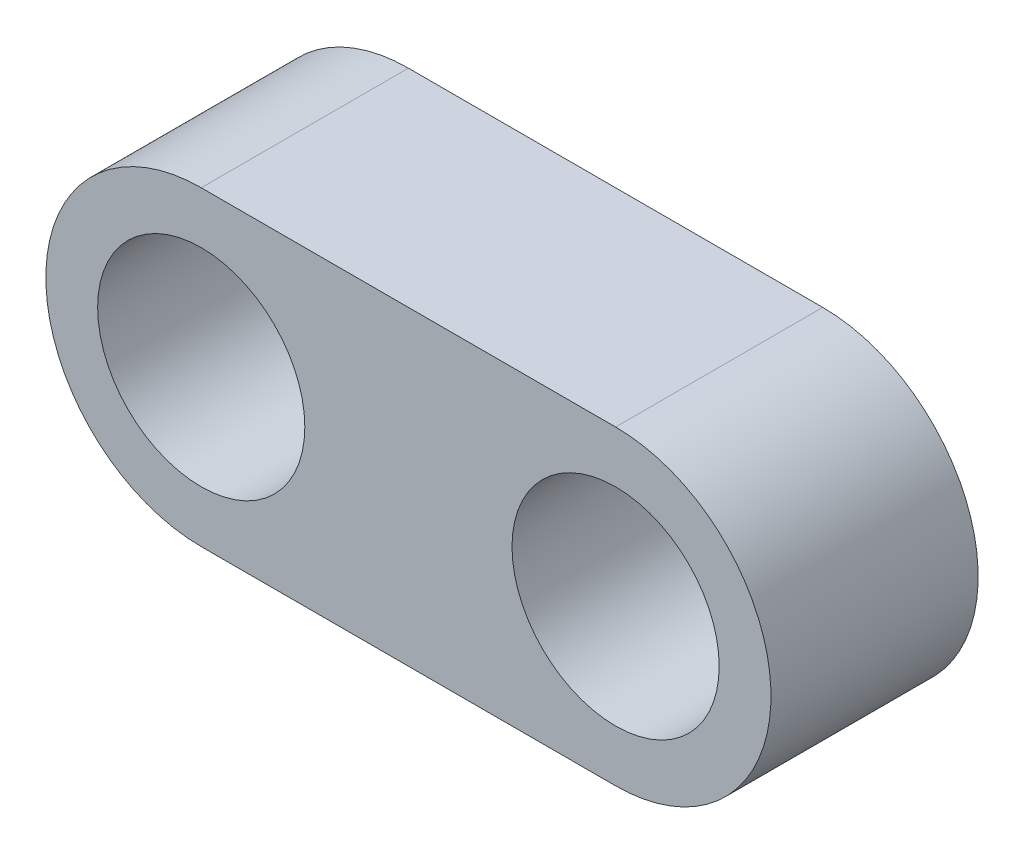
from build123d import *

# Parameters (mm, degrees)
SKETCH1_R           = 1.5
SKETCH1_R_2         = 1
BOSS_EXTRUDE1_DEPTH = 2


with BuildPart() as part:
    # Sketch1 → Boss-Extrude1 (new body)
    # profile 1 of 3: a face of its own
    with BuildSketch(Plane.XY):
        with Locations((-2, 0)):
            Circle(SKETCH1_R)
        with Locations((-2, 0)):
            Circle(SKETCH1_R_2, mode=Mode.SUBTRACT)
    # profile 2 of 3: a face of its own
    with BuildSketch(Plane.XY):
        with BuildLine():
            ThreePointArc((-0.5, 0), (-0.939339828, -1.060660172), (-2, -1.5))
            Line((-2, -1.5), (2, -1.5))
            ThreePointArc((2, -1.5), (0.5, 0), (2, 1.5))
            Line((2, 1.5), (-2, 1.5))
            ThreePointArc((-2, 1.5), (-0.939339828, 1.060660172), (-0.5, 0))
        make_face()
    # profile 3 of 3: a face of its own
    with BuildSketch(Plane.XY):
        with Locations((2, 0)):
            Circle(SKETCH1_R)
        with Locations((2, 0)):
            Circle(SKETCH1_R_2, mode=Mode.SUBTRACT)
    extrude(amount=BOSS_EXTRUDE1_DEPTH)


solid = part.part
